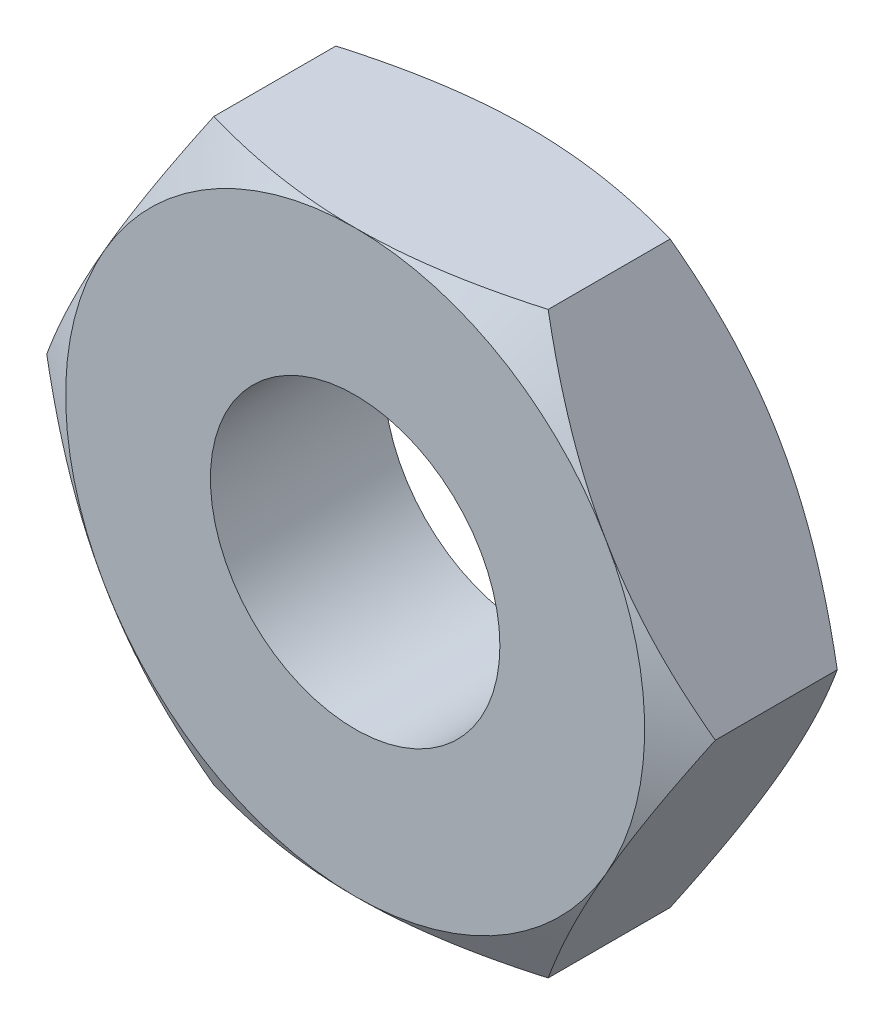
from build123d import *

# Parameters (mm, degrees)
HEX_2_DEPTH          = 1.2
THREAD_BORESKETCH4_R = 1
THREAD_BORE_DEPTH    = 4.282275633


with BuildPart() as part:
    # HexSketch1 → Hex 2 (new body)
    with BuildSketch(Plane.XY):
        Polygon((1.154700538, 2), (-1.154700538, 2), (-2.309401077, 0), (-1.154700538, -2), (1.154700538, -2), (2.309401077, 0), align=None)
    extrude(amount=-HEX_2_DEPTH)

    # Thread_BoreSketch4 → Thread_Bore (cut, through all)
    with BuildSketch(Plane.XY):
        Circle(THREAD_BORESKETCH4_R)
    extrude(amount=-THREAD_BORE_DEPTH, mode=Mode.SUBTRACT)

    # NUT_CHAMFERSketch10 → NUT_CHAMFER (revolve, cut)
    with BuildSketch(Plane(origin=(0, 0, 0), x_dir=(0, 0, -1), z_dir=(0.8660254037844385, 0.5000000000000002, 0))):
        Polygon((0, 2), (0.178632795, 2.309401077), (0, 2.309401077), align=None)
        Polygon((1.2, 2), (1.021367205, 2.309401077), (1.2, 2.309401077), align=None)
    revolve(axis=Axis((0, 0, 50), (0, 0, -1)), mode=Mode.SUBTRACT)


solid = part.part
